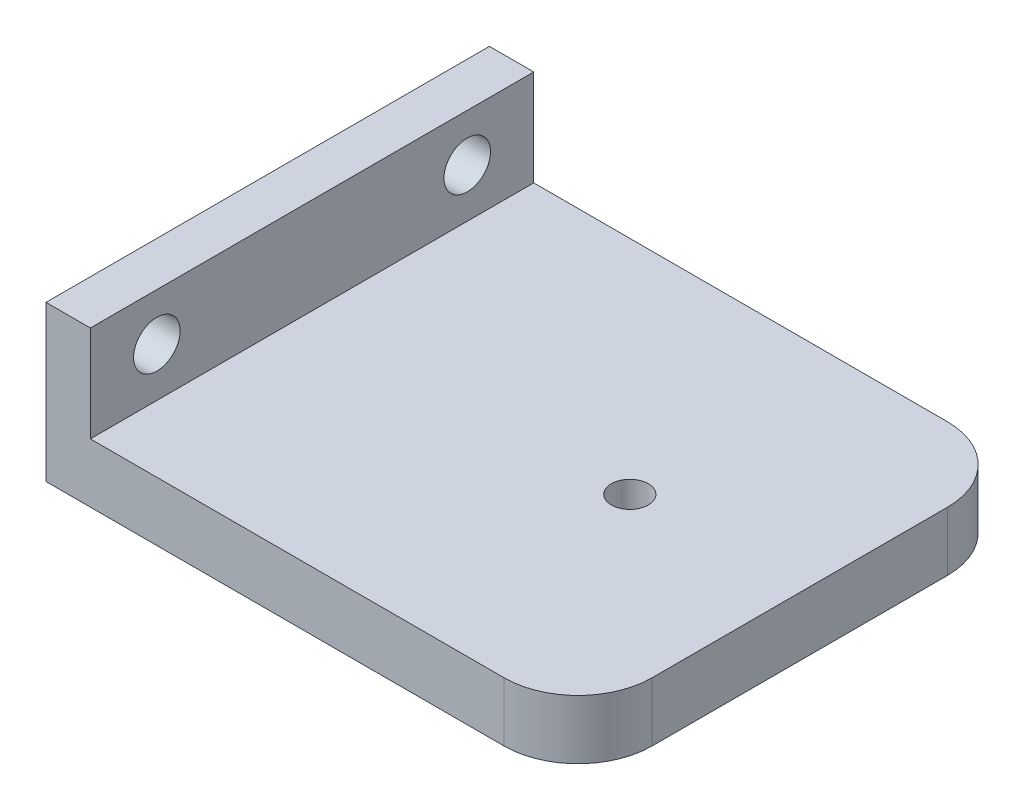
from build123d import *

# Parameters (mm, degrees)
SKETCH1_W           = 30
SKETCH1_H           = 10.5
BOSS_EXTRUDE1_DEPTH = 3
SKETCH2_W           = 30
SKETCH2_H           = 4
BOSS_EXTRUDE2_DEPTH = 33
FILLET1_R           = 5
SKETCH3_R           = 1.575
CUT_EXTRUDE1_DEPTH  = 37.627346341
SKETCH4_R           = 1.575
CUT_EXTRUDE2_DEPTH  = 37.627346341
SKETCH5_R           = 1.25
CUT_EXTRUDE3_DEPTH  = 41.388736054


with BuildPart() as part:
    # Sketch1 → Boss-Extrude1 (new body)
    with BuildSketch(Plane(origin=(0, 0, 0), x_dir=(0, 0, -1), z_dir=(1, 0, 0))):
        Rectangle(SKETCH1_W, SKETCH1_H)
    extrude(amount=BOSS_EXTRUDE1_DEPTH)

    # Sketch2 → Boss-Extrude2 (add)
    with BuildSketch(Plane(origin=(3, 0, 0), x_dir=(0, 0, -1), z_dir=(1, 0, 0))):
        with Locations((0, -3.25)):
            Rectangle(SKETCH2_W, SKETCH2_H)
    extrude(amount=BOSS_EXTRUDE2_DEPTH)

    # Fillet1
    fillet1_edges = [part.edges().sort_by_distance(p)[0] for p in [
        (36, -3.25, 15),
        (36, -3.25, -15),
    ]]
    fillet(fillet1_edges, radius=FILLET1_R)

    # Sketch3 → Cut-Extrude1 (cut, through all)
    with BuildSketch(Plane(origin=(3, 0, 0), x_dir=(0, 0, -1), z_dir=(1, 0, 0))):
        with Locations((-10.5, 2.05)):
            Circle(SKETCH3_R)
    extrude(amount=-CUT_EXTRUDE1_DEPTH, mode=Mode.SUBTRACT)

    # Sketch4 → Cut-Extrude2 (cut, through all)
    with BuildSketch(Plane(origin=(3, 0, 0), x_dir=(0, 0, -1), z_dir=(1, 0, 0))):
        with Locations((10.5, 2.05)):
            Circle(SKETCH4_R)
    extrude(amount=-CUT_EXTRUDE2_DEPTH, mode=Mode.SUBTRACT)

    # Sketch5 → Cut-Extrude3 (cut, through all)
    with BuildSketch(Plane(origin=(0, -5.25, 0), x_dir=(-1, 0, 0), z_dir=(0, -1, 0))):
        with Locations(Location((-24.5, 0, 0), (0, 0, 90))):
            Circle(SKETCH5_R)
    extrude(amount=-CUT_EXTRUDE3_DEPTH, mode=Mode.SUBTRACT)


solid = part.part
